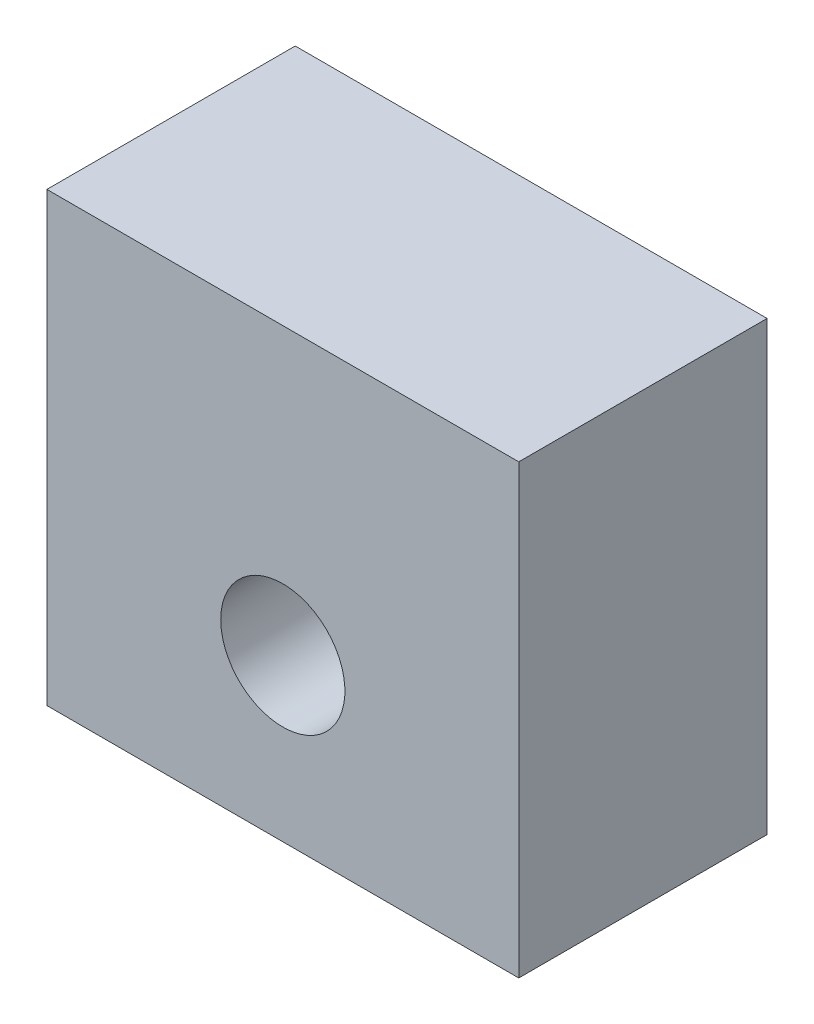
from build123d import *

# Parameters (mm, degrees)
SKETCH_1_W          = 19
SKETCH_1_H          = 18
EXTRUDE_1_DEPTH     = 10
SKETCH_2_R          = 2.5
CUT_EXTRUDE_1_DEPTH = 29.017851452


with BuildPart() as part:
    # Эскиз1 → Бобышка-Вытянуть1 (new body)
    with BuildSketch(Plane.XY):
        with Locations((9.5, 9)):
            Rectangle(SKETCH_1_W, SKETCH_1_H)
    extrude(amount=EXTRUDE_1_DEPTH)

    # Эскиз2 → Вырез-Вытянуть1 (cut, through all)
    with BuildSketch(Plane(origin=(0, 0, 0), x_dir=(-1, 0, 0), z_dir=(0, 0, -1))):
        with Locations((-9.5, 6.5)):
            Circle(SKETCH_2_R)
    extrude(amount=-CUT_EXTRUDE_1_DEPTH, mode=Mode.SUBTRACT)


solid = part.part
